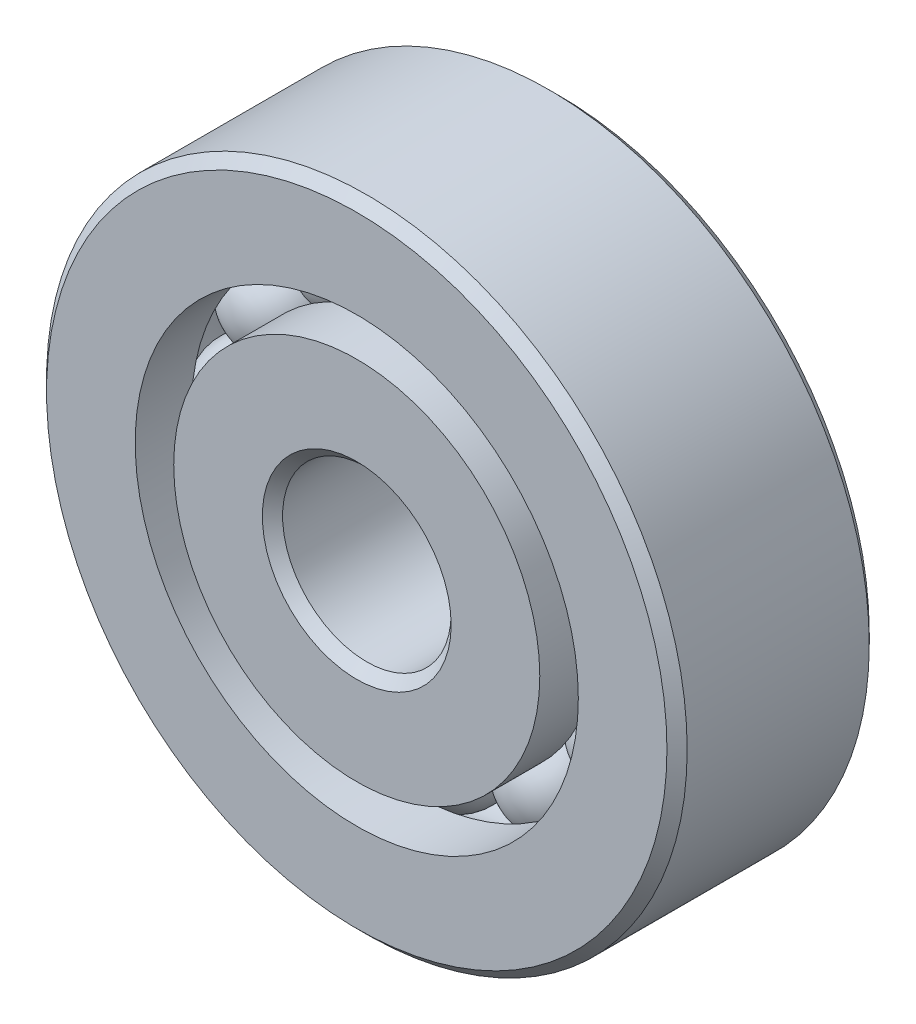
from build123d import *

# Parameters (mm, degrees)
CIRPATTERN1_COUNT = 12


with BuildPart() as part:
    # Sketch1 → Revolve1 (revolve)
    with BuildSketch(Plane(origin=(0, 0, 0), x_dir=(0, 0, -1), z_dir=(1, 0, 0)), mode=Mode.PRIVATE) as revolve1_sk:
        with BuildLine():
            Line((2.7, 9.5), (-2.7, 9.5))
            Line((-2.7, 9.5), (-3, 9.2))
            Line((-3, 9.2), (-3, 6.571428571))
            Line((-3, 6.571428571), (-1.333333333, 6.571428571))
            ThreePointArc((-1.333333333, 6.571428571), (0, 7.450623449), (1.333333333, 6.571428571))
            Line((1.333333333, 6.571428571), (3, 6.571428571))
            Line((3, 6.571428571), (3, 9.2))
            Line((3, 9.2), (2.7, 9.5))
        make_face()
    revolve(revolve1_sk.sketch.rotate(Axis((0, 0, 3), (0, 0, -1)), 90), axis=Axis((0, 0, 3), (0, 0, -1)))


with BuildPart() as body_2:
    # Sketch3 → Revolve3 (revolve)
    with BuildSketch(Plane(origin=(0, 0, 0), x_dir=(0, 0, -1), z_dir=(1, 0, 0)), mode=Mode.PRIVATE) as revolve3_sk:
        with BuildLine():
            Line((-3, 5.428571429), (-1.333333333, 5.428571429))
            ThreePointArc((-1.333333333, 5.428571429), (0, 4.549376551), (1.333333333, 5.428571429))
            Line((1.333333333, 5.428571429), (3, 5.428571429))
            Line((3, 5.428571429), (3, 2.8))
            Line((3, 2.8), (2.7, 2.5))
            Line((2.7, 2.5), (-2.7, 2.5))
            Line((-2.7, 2.5), (-3, 2.8))
            Line((-3, 2.8), (-3, 5.428571429))
        make_face()
    revolve(revolve3_sk.sketch.rotate(Axis((0, 0, 3), (0, 0, -1)), 90), axis=Axis((0, 0, 3), (0, 0, -1)))


with BuildPart() as body_3:
    # Sketch4 → Revolve4 (revolve)
    with BuildSketch(Plane(origin=(0, 0, 0), x_dir=(0, 0, -1), z_dir=(1, 0, 0))):
        with BuildLine():
            Line((-1.450623449, 6), (1.450623449, 6))
            ThreePointArc((1.450623449, 6), (0, 7.450623449), (-1.450623449, 6))
        make_face()
    revolve(axis=Axis((0, 6, 1.450623449), (0, 0, -1)))


with BuildPart() as cirpattern1_1:
    # CirPattern1: pattern copy
    add(body_3.part.rotate(Axis((0, 0, 0), (0, 0, 1)), 1 * 360 / CIRPATTERN1_COUNT))


with BuildPart() as cirpattern1_2:
    # CirPattern1: pattern copy
    add(body_3.part.rotate(Axis((0, 0, 0), (0, 0, 1)), 2 * 360 / CIRPATTERN1_COUNT))


with BuildPart() as cirpattern1_3:
    # CirPattern1: pattern copy
    add(body_3.part.rotate(Axis((0, 0, 0), (0, 0, 1)), 3 * 360 / CIRPATTERN1_COUNT))


with BuildPart() as cirpattern1_4:
    # CirPattern1: pattern copy
    add(body_3.part.rotate(Axis((0, 0, 0), (0, 0, 1)), 4 * 360 / CIRPATTERN1_COUNT))


with BuildPart() as cirpattern1_5:
    # CirPattern1: pattern copy
    add(body_3.part.rotate(Axis((0, 0, 0), (0, 0, 1)), 5 * 360 / CIRPATTERN1_COUNT))


with BuildPart() as cirpattern1_6:
    # CirPattern1: pattern copy
    add(body_3.part.rotate(Axis((0, 0, 0), (0, 0, 1)), 6 * 360 / CIRPATTERN1_COUNT))


with BuildPart() as cirpattern1_7:
    # CirPattern1: pattern copy
    add(body_3.part.rotate(Axis((0, 0, 0), (0, 0, 1)), 7 * 360 / CIRPATTERN1_COUNT))


with BuildPart() as cirpattern1_8:
    # CirPattern1: pattern copy
    add(body_3.part.rotate(Axis((0, 0, 0), (0, 0, 1)), 8 * 360 / CIRPATTERN1_COUNT))


with BuildPart() as cirpattern1_9:
    # CirPattern1: pattern copy
    add(body_3.part.rotate(Axis((0, 0, 0), (0, 0, 1)), 9 * 360 / CIRPATTERN1_COUNT))


with BuildPart() as cirpattern1_10:
    # CirPattern1: pattern copy
    add(body_3.part.rotate(Axis((0, 0, 0), (0, 0, 1)), 10 * 360 / CIRPATTERN1_COUNT))


with BuildPart() as cirpattern1_11:
    # CirPattern1: pattern copy
    add(body_3.part.rotate(Axis((0, 0, 0), (0, 0, 1)), 11 * 360 / CIRPATTERN1_COUNT))


solid = Compound([part.part, body_2.part, body_3.part, cirpattern1_1.part, cirpattern1_2.part, cirpattern1_3.part, cirpattern1_4.part, cirpattern1_5.part, cirpattern1_6.part, cirpattern1_7.part, cirpattern1_8.part, cirpattern1_9.part, cirpattern1_10.part, cirpattern1_11.part])
